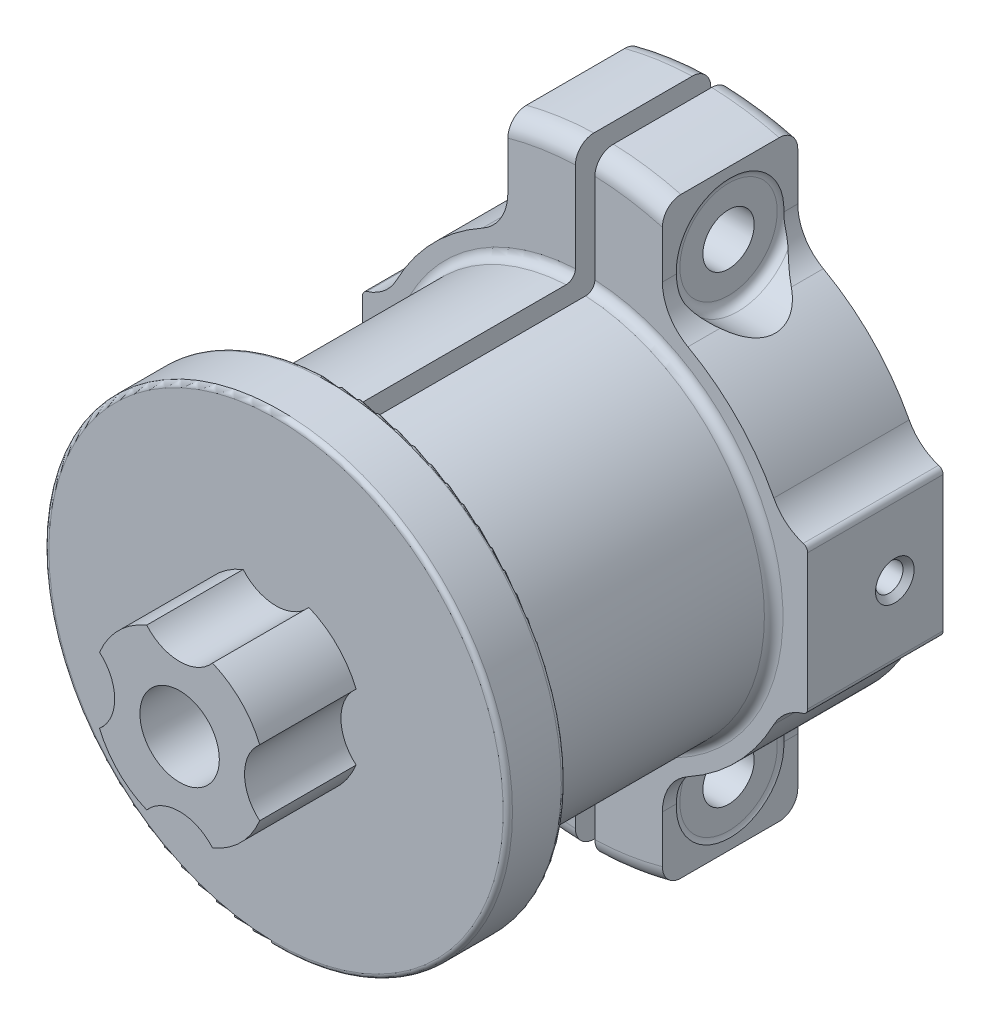
from build123d import *

# Parameters (mm, degrees)
FILLET1_R                       = 0.762
FILLET2_R                       = 1.524
FILLET3_R                       = 0.381
EXTRUDE1_REACH                  = 58.925
SKETCH5_W                       = 1.6002
SKETCH5_H                       = 58.011088785
EXTRUDE2_DEPTH                  = 33.02
F_4_40_TAPPED_HOLE1_D           = 2.2606
F_4_40_TAPPED_HOLE1_DEPTH       = 8.8646
F_4_40_TAPPED_HOLE1_CSINK_D     = 3.175
F_4_40_TAPPED_HOLE1_CSINK_ANGLE = 90
F_4_40_TAPPED_HOLE1_TIP         = 0.679152758
SKETCH15_R                      = 3.556
CUT_EXTRUDE1_DEPTH              = 49.25633541
CIRPATTERN1_COUNT               = 4


with BuildPart() as part:
    # Sketch1 → Revolve1 (revolve)
    with BuildSketch(Plane(origin=(0, 0, 0), x_dir=(0, 0, -1), z_dir=(1, 0, 0))):
        Polygon((20.6502, 12.7), (36.5252, 12.7), (36.5252, 25.146), (25.4, 25.146), (25.4, 15.494), (4.7752, 15.494), (4.7752, 19.05), (0, 19.05), (0, 7.112), (-7.9248, 7.112), (-7.9248, 3.2639), (1.759856755, 3.2639), (3.175, 5.715), (3.175, 12.954), (17.017830771, 12.954), align=None)
    revolve(axis=Axis((0, 0, -22.962475242), (0, 0, -1)))

    # Fillet1
    fillet1_edges = [part.edges().sort_by_distance(p)[0] for p in [
        (0, -15.494, -25.4),
        (0, -15.494, -4.7752),
    ]]
    fillet(fillet1_edges, radius=FILLET1_R)

    # Fillet2
    fillet2_edges = [part.edges().sort_by_distance(p)[0] for p in [
        (0, -25.146, -36.5252),
        (0, -25.146, -25.4),
    ]]
    fillet(fillet2_edges, radius=FILLET2_R)

    # Fillet3
    fillet3_edges = [part.edges().sort_by_distance(p)[0] for p in [
        (0, -19.05, 0),
        (0, -19.05, -4.7752),
    ]]
    fillet(fillet3_edges, radius=FILLET3_R)

    # Sketch4 → Extrude1 (cut, up to next)
    with BuildSketch(Plane(origin=(0, 0, -36.5252), x_dir=(-1, 0, 0), z_dir=(0, 0, -1)), mode=Mode.PRIVATE) as extrude1_sk1:
        with BuildLine():
            Line((6.35, 29.81120427), (6.35, 18.854329493))
            ThreePointArc((6.35, 18.854329493), (6.913894816, 16.789054766), (8.44909434, 15.296908834))
            ThreePointArc((8.44909434, 15.296908834), (12.511151842, 12.200561243), (15.504429053, 8.061965938))
            ThreePointArc((15.504429053, 8.061965938), (16.513069054, 6.810906175), (17.927790025, 6.04862686))
            ThreePointArc((17.927790025, 6.04862686), (18.188130698, 5.86507865), (18.288, 5.5626))
            Line((18.288, 5.5626), (18.288, -5.5626))
            ThreePointArc((18.288, -5.5626), (18.188130698, -5.86507865), (17.927790025, -6.04862686))
            ThreePointArc((17.927790025, -6.04862686), (16.513069054, -6.810906175), (15.504429053, -8.061965938))
            ThreePointArc((15.504429053, -8.061965938), (12.511151842, -12.200561243), (8.44909434, -15.296908834))
            ThreePointArc((8.44909434, -15.296908834), (6.913894816, -16.789054766), (6.35, -18.854329493))
            Line((6.35, -18.854329493), (6.35, -29.81120427))
            ThreePointArc((6.35, -29.81120427), (30.48, 0), (6.35, 29.81120427))
        make_face()
    extrude1_tool1 = extrude(extrude1_sk1.sketch, amount=-EXTRUDE1_REACH, mode=Mode.PRIVATE) & part.part
    extrude1 = extrude1_tool1.solids().sort_by_distance((-6.993202, 24.332767, -36.5252))[0]
    add(extrude1, mode=Mode.SUBTRACT)

    # Mirror1: Extrude1 across plane
    add(extrude1.mirror(Plane(origin=(0, 0, 0), x_dir=(0, 0, 1), z_dir=(1, 0, 0))), mode=Mode.SUBTRACT)

    # Sketch11 → Cut-Revolve1 (revolve, cut)
    with BuildSketch(Plane(origin=(0, 0, -30.9626), x_dir=(-1, 0, 0), z_dir=(0, 0, -1))):
        with BuildLine():
            Line((-11.303, 23.8125), (-6.985, 23.8125))
            ThreePointArc((-6.985, 23.8125), (-6.446184633, 23.589315367), (-6.223, 23.0505))
            Line((-6.223, 23.0505), (-6.223, 21.1582))
            Line((-6.223, 21.1582), (0, 21.1582))
            Line((0, 21.1582), (0, 20.7772))
            Line((0, 20.7772), (11.43, 20.7772))
            Line((11.43, 20.7772), (11.43, 19.05))
            Line((11.43, 19.05), (-11.303, 19.05))
            Line((-11.303, 19.05), (-11.303, 23.8125))
        make_face()
    cut_revolve1 = revolve(axis=Axis((11.303, 19.05, -30.9626), (1, 0, 0)), mode=Mode.SUBTRACT)

    # Mirror2: Cut-Revolve1 across plane
    add(cut_revolve1.mirror(Plane.ZX), mode=Mode.SUBTRACT)

    # Sketch5 → Extrude2 (cut, symmetric)
    with BuildSketch(Plane(origin=(0, 0, -36.5252), x_dir=(-1, 0, 0), z_dir=(0, -1, 0))):
        with Locations((0, -2.236455607)):
            Rectangle(SKETCH5_W, SKETCH5_H)
    extrude(amount=EXTRUDE2_DEPTH, both=True, mode=Mode.SUBTRACT)

    # #4-40 Tapped Hole1
    with Locations(Plane(origin=(18.288, 0, 0), x_dir=(0, 0, -1), z_dir=(1, 0, 0))):
        with Locations((32.5628, 0)):
            CounterSinkHole(F_4_40_TAPPED_HOLE1_D / 2, F_4_40_TAPPED_HOLE1_CSINK_D / 2, depth=F_4_40_TAPPED_HOLE1_DEPTH, counter_sink_angle=F_4_40_TAPPED_HOLE1_CSINK_ANGLE)
            with Locations((0, 0, -(F_4_40_TAPPED_HOLE1_DEPTH + F_4_40_TAPPED_HOLE1_TIP / 2))):  # 118° drill point
                Cone(0, F_4_40_TAPPED_HOLE1_D / 2, F_4_40_TAPPED_HOLE1_TIP, mode=Mode.SUBTRACT)

    # Sketch15 → Cut-Extrude1 (cut, through all)
    with BuildSketch(Plane.XY):
        with Locations((8.89, 0)):
            Circle(SKETCH15_R)
    cut_extrude1 = extrude(amount=CUT_EXTRUDE1_DEPTH, mode=Mode.SUBTRACT)

    # CirPattern1: Cut-Extrude1 ×4 about axis
    cirpattern1_axis = Axis((0, 0, -80.9), (0, 0, 1))
    for i in range(1, CIRPATTERN1_COUNT):
        add(cut_extrude1.rotate(cirpattern1_axis, i * 360 / CIRPATTERN1_COUNT), mode=Mode.SUBTRACT)


solid = part.part
